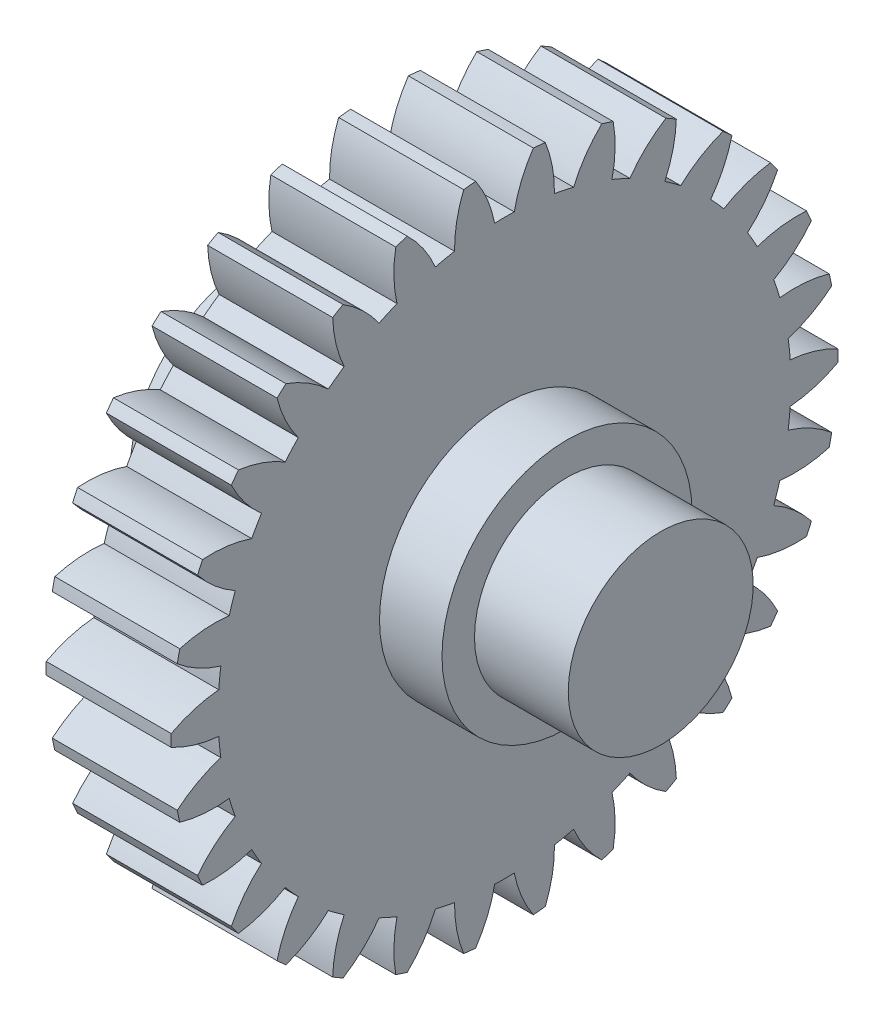
from build123d import *

# Parameters (mm, degrees)
BASPROSKE_W         = 12.7
BASPROSKE_H         = 33.866666667
TOOTHCUT_DEPTH      = 50.549896289
TEETHCUTS_COUNT     = 30
TEETHCUTS_ANGLE     = 348
SKETCH1_R           = 12.7
SKETCH1_R_2         = 4.953
BOSS_EXTRUDE2_DEPTH = 12.7
SKETCH3_R           = 3.302
CUT_EXTRUDE1_DEPTH  = 50.463042002
CUT_EXTRUDE2_DEPTH  = 8.255
BOSS_EXTRUDE3_START = 6.35
SKETCH5_R           = 12.7
BOSS_EXTRUDE3_DEPTH = 6.35
SKETCH6_R           = 9.398
BOSS_EXTRUDE4_DEPTH = 9.525


with BuildPart() as part:
    # BasProSke → Base-Revolve (revolve)
    with BuildSketch(Plane(origin=(0, 0, 0), x_dir=(1, 0, 0), z_dir=(0, 1, 0)), mode=Mode.PRIVATE) as base_revolve_sk:
        with Locations((6.35, 16.933333334)):
            Rectangle(BASPROSKE_W, BASPROSKE_H)
    revolve(base_revolve_sk.sketch.rotate(Axis((-10, 0, 0), (1, 0, 0)), 180), axis=Axis((-10, 0, 0), (1, 0, 0)))

    # TooCutSke → ToothCut (cut, through all)
    with BuildSketch(Plane(origin=(0, 0, 0), x_dir=(0, 0, -1), z_dir=(1, 0, 0))):
        with BuildLine():
            ThreePointArc((0.995262134, 29.085873679), (0, 29.102896667), (-0.995262134, 29.085873679))
            ThreePointArc((-0.995262134, 29.085873679), (-1.736289099, 31.523168017), (-2.948832865, 33.763539028))
            ThreePointArc((-2.948832865, 33.763539028), (0, 33.892066667), (2.948832865, 33.763539028))
            ThreePointArc((2.948832865, 33.763539028), (1.736289099, 31.523168017), (0.995262134, 29.085873679))
        make_face()
    toothcut = extrude(amount=TOOTHCUT_DEPTH, mode=Mode.SUBTRACT)

    # TeethCuts: ToothCut ×30 about axis
    teethcuts_axis = Axis((-10, 0, 0), (1, 0, 0))
    for i in range(1, TEETHCUTS_COUNT):
        add(toothcut.rotate(teethcuts_axis, i * TEETHCUTS_ANGLE / (TEETHCUTS_COUNT - 1)), mode=Mode.SUBTRACT)

    # Sketch1 → Boss-Extrude2 (add)
    with BuildSketch(Plane.ZY):
        with Locations(Location((0, 0, 0), (0, 0, 180))):
            Circle(SKETCH1_R)
        Circle(SKETCH1_R_2, mode=Mode.SUBTRACT)
    extrude(amount=BOSS_EXTRUDE2_DEPTH)

    # Sketch3 → Cut-Extrude1 (cut, through all)
    with BuildSketch(Plane(origin=(0, 0, 0), x_dir=(1, 0, 0), z_dir=(0, 1, 0))):
        with Locations(Location((-6.35, 0, 0), (0, 0, 90))):
            Circle(SKETCH3_R)
    extrude(amount=CUT_EXTRUDE1_DEPTH, mode=Mode.SUBTRACT)

    # Sketch4 → Cut-Extrude2 (cut)
    with BuildSketch(Plane(origin=(0, 0, 0), x_dir=(1, 0, 0), z_dir=(0, 1, 0))):
        Polygon((-3.527045859, 4.8895), (-9.172954141, 4.8895), (-11.995908282, 0), (-9.172954141, -4.8895), (-3.527045859, -4.8895), (-0.704091718, 0), align=None)
    extrude(amount=CUT_EXTRUDE2_DEPTH, mode=Mode.SUBTRACT)

    # Sketch5 → Boss-Extrude3 (add)
    with BuildSketch(Plane(origin=(12.7, 0, 0), x_dir=(0, 0, -1), z_dir=(1, 0, 0)).offset(BOSS_EXTRUDE3_START)):
        Circle(SKETCH5_R)
    extrude(amount=-BOSS_EXTRUDE3_DEPTH)

    # Sketch6 → Boss-Extrude4 (add)
    with BuildSketch(Plane(origin=(19.05, 0, 0), x_dir=(0, 0, -1), z_dir=(1, 0, 0))):
        with Locations(Location((0, 0, 0), (0, 0, 180))):
            Circle(SKETCH6_R)
    extrude(amount=BOSS_EXTRUDE4_DEPTH)


solid = part.part
